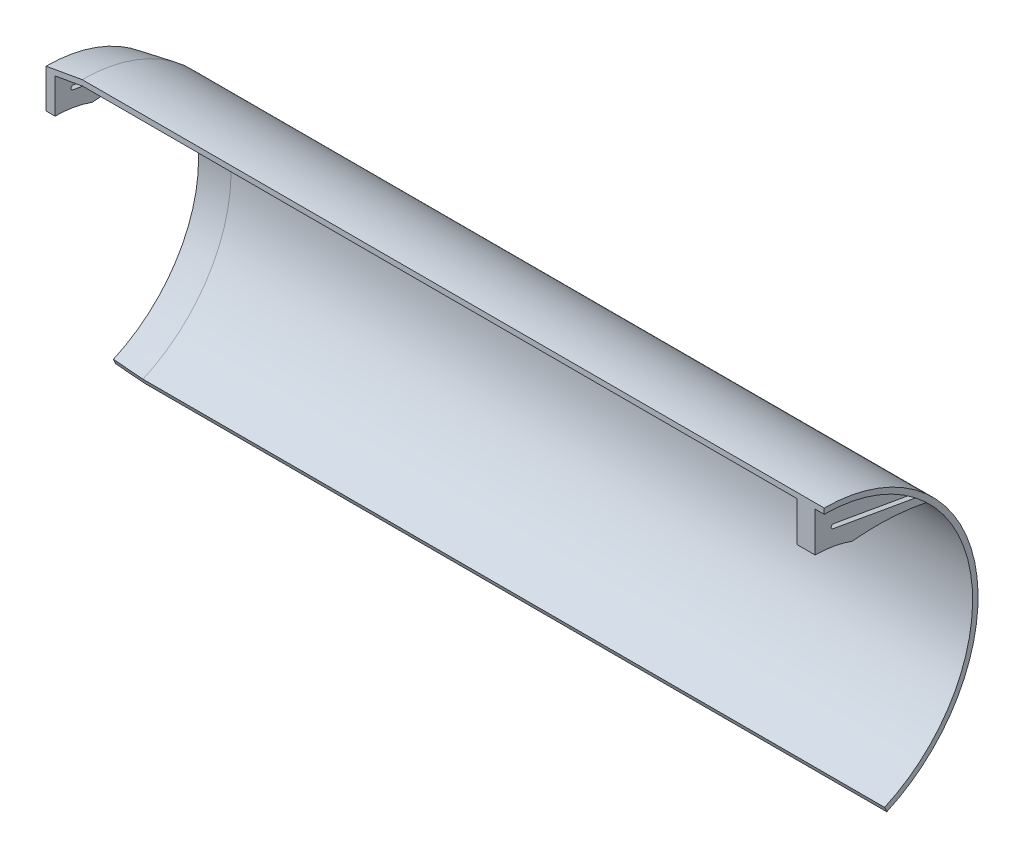
from build123d import *

# Parameters (mm, degrees)
REVOLVE5_ANGLE          = 156
SKETCH4_OUTSIDE_W       = 180.506
SKETCH4_OUTSIDE_H       = 258.157
CUT_EXTRUDE2_DEPTH      = 170
CUT_EXTRUDE3_DEPTH      = 442.672956065
CUT_EXTRUDE3_DEPTH_BACK = 10
SKETCH5_OUTSIDE_W       = 180.506
SKETCH5_OUTSIDE_H       = 258.157


with BuildPart() as part:
    # Sketch1 → Revolve5 (revolve)
    with BuildSketch(Plane.XY):
        with BuildLine():
            Line((560, 85), (150, 85))
            add(Edge.make_bspline(
                [(130, 81.42814839), (131.199611639, 81.653568948), (134.531160345, 82.27353853), (140.063409966, 83.276352633), (145.198462089, 84.177415336), (148.333178957, 84.715838785), (149.39998937, 84.897876633), (149.733326587, 84.954653305), (149.933332963, 84.98866355), (150, 85)],
                knots=[0.892972089, 0.892972089, 0.892972089, 0.892972089, 0.912262482, 0.946527454, 0.981827786, 0.994656092, 0.99679374, 0.998931275, 1, 1, 1, 1], degree=3))
            Line((130, 81.42814839), (130, 60))
            Line((130, 60), (135, 60))
            Line((135, 60), (135, 79.305358628))
            add(Edge.make_bspline(
                [(135, 79.305358628), (135.41688533, 79.381868697), (140.494804486, 80.310770929), (145.581915204, 81.204990099), (150.253322265, 82)],
                knots=[0.916860703, 0.916860703, 0.916860703, 0.916860703, 0.923577482, 0.99866409, 0.99866409, 0.99866409, 0.99866409], degree=3))
            Line((150.253322265, 82), (545, 82))
            Line((545, 82), (545, 60))
            Line((545, 60), (555, 60))
            Line((555, 60), (555, 82))
            Line((555, 82), (560, 82))
            Line((560, 82), (560, 85))
        make_face()
    revolve(axis=Axis((2.999985029, 0, 0), (-1, 0, 0)), revolution_arc=REVOLVE5_ANGLE)

    # Sketch4 outside → Cut-Extrude2 (cut)
    with BuildSketch(Plane.ZY.offset(-135)):
        with Locations((-42.5, 3.6745)):
            Rectangle(SKETCH4_OUTSIDE_W, SKETCH4_OUTSIDE_H)
        with BuildLine():
            Line((0, 60), (0, 82.355324155))
            ThreePointArc((0, 82.355324155), (-28.788899936, 77.159566207), (-53.94524406, 62.227888121))
            Line((-53.94524406, 62.227888121), (-10.199695404, 69.941408635))
            ThreePointArc((-10.199695404, 69.941408635), (-8.867471084, 69.008575123), (-9.800304596, 67.676350803))
            Line((-9.800304596, 67.676350803), (-57.112993118, 59.333847287))
            ThreePointArc((-57.112993118, 59.333847287), (-59.561955461, 56.875063765), (-61.905157801, 54.315291165))
            ThreePointArc((-61.905157801, 54.315291165), (-41.293069586, 56.9484186), (-20.5212086, 56.381557247))
            ThreePointArc((-20.5212086, 56.381557247), (-10.41889066, 59.088465181), (0, 60))
        make_face(mode=Mode.SUBTRACT)
    extrude(amount=CUT_EXTRUDE2_DEPTH, mode=Mode.SUBTRACT)

    # Sketch5 outside → Cut-Extrude3 (cut, two sides: drawn at the far end of the back side and taken through both)
    # profile 1 of 2: a face of its own
    with BuildSketch(Plane(origin=(555, 0, 0), x_dir=(0, 0, -1), z_dir=(1, 0, 0)).offset(-CUT_EXTRUDE3_DEPTH_BACK)):
        with Locations((42.5, 3.6745)):
            Rectangle(SKETCH5_OUTSIDE_W, SKETCH5_OUTSIDE_H)
        with BuildLine():
            Line((0, 85), (0, 60))
            ThreePointArc((0, 60), (10.41889066, 59.088465181), (20.5212086, 56.381557247))
            ThreePointArc((20.5212086, 56.381557247), (40.998184687, 56.962818166), (61.326696118, 54.433779432))
            ThreePointArc((61.326696118, 54.433779432), (80.146948816, -17.333972293), (33.352404732, -74.910727527))
            Line((33.352404732, -74.910727527), (34.572614661, -77.6513639))
            ThreePointArc((34.572614661, -77.6513639), (83.142546062, 17.67249372), (0, 85))
        make_face(mode=Mode.SUBTRACT)
    # profile 2 of 2: a face of its own
    with BuildSketch(Plane(origin=(555, 0, 0), x_dir=(0, 0, -1), z_dir=(1, 0, 0)).offset(-CUT_EXTRUDE3_DEPTH_BACK)):
        with BuildLine():
            Line((9.800304596, 67.676350803), (56.482682204, 59.444988107))
            ThreePointArc((56.482682204, 59.444988107), (54.890605033, 60.918153937), (53.260119726, 62.348694026))
            Line((53.260119726, 62.348694026), (10.199695404, 69.941408635))
            ThreePointArc((10.199695404, 69.941408635), (8.867471084, 69.008575123), (9.800304596, 67.676350803))
        make_face()
    extrude(amount=CUT_EXTRUDE3_DEPTH + CUT_EXTRUDE3_DEPTH_BACK, mode=Mode.SUBTRACT)


solid = part.part
